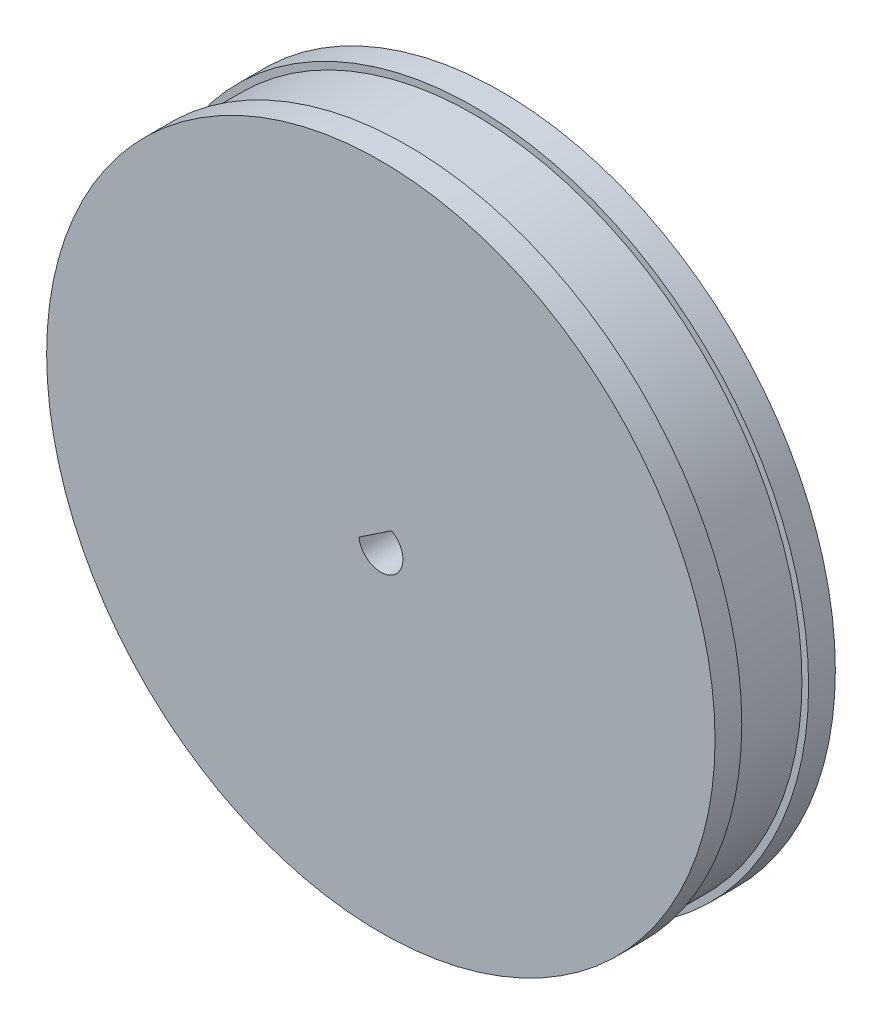
from build123d import *

# Parameters (mm, degrees)
ESQUISSE1_R             = 24.5
BOSS_EXTRU_1_DEPTH      = 5
ESQUISSE2_R             = 25
BOSS_EXTRU_2_DEPTH      = 2
BOSS_EXTRU_4_START      = 2
ESQUISSE5_R             = 25
BOSS_EXTRU_4_DEPTH      = 2
ESQUISSE4_R             = 1.65
ENL_V_MAT_EXTRU_1_DEPTH = 37.482872694
BOSS_EXTRU_5_DEPTH      = 9


with BuildPart() as part:
    # Esquisse1 → Boss.-Extru.1 (new body)
    with BuildSketch(Plane.XY):
        Circle(ESQUISSE1_R)
    extrude(amount=BOSS_EXTRU_1_DEPTH)

    # Esquisse2 → Boss.-Extru.2 (add)
    with BuildSketch(Plane(origin=(0, 0, 0), x_dir=(-1, 0, 0), z_dir=(0, 0, -1))):
        Circle(ESQUISSE2_R)
    extrude(amount=BOSS_EXTRU_2_DEPTH)

    # Esquisse5 → Boss.-Extru.4 (add)
    with BuildSketch(Plane.XY.offset(5).offset(BOSS_EXTRU_4_START)):
        with Locations(Location((0, 0, 0), (0, 0, 180))):
            Circle(ESQUISSE5_R)
    extrude(amount=-BOSS_EXTRU_4_DEPTH)

    # Esquisse4 → Enlèv. mat.-Extru.1 (cut, through all)
    with BuildSketch(Plane(origin=(0, 0, -2), x_dir=(-1, 0, 0), z_dir=(0, 0, -1))):
        Circle(ESQUISSE4_R)
    extrude(amount=-ENL_V_MAT_EXTRU_1_DEPTH, mode=Mode.SUBTRACT)

    # Esquisse6 → Boss.-Extru.5 (add, through all)
    with BuildSketch(Plane.XY.offset(7)):
        with BuildLine():
            Line((-1.638440884, -0.194965301), (0.803526302, 1.441126463))
            ThreePointArc((0.803526302, 1.441126463), (-0.91840604, 1.370777278), (-1.638440884, -0.194965301))
        make_face()
    extrude(amount=-BOSS_EXTRU_5_DEPTH)


solid = part.part
